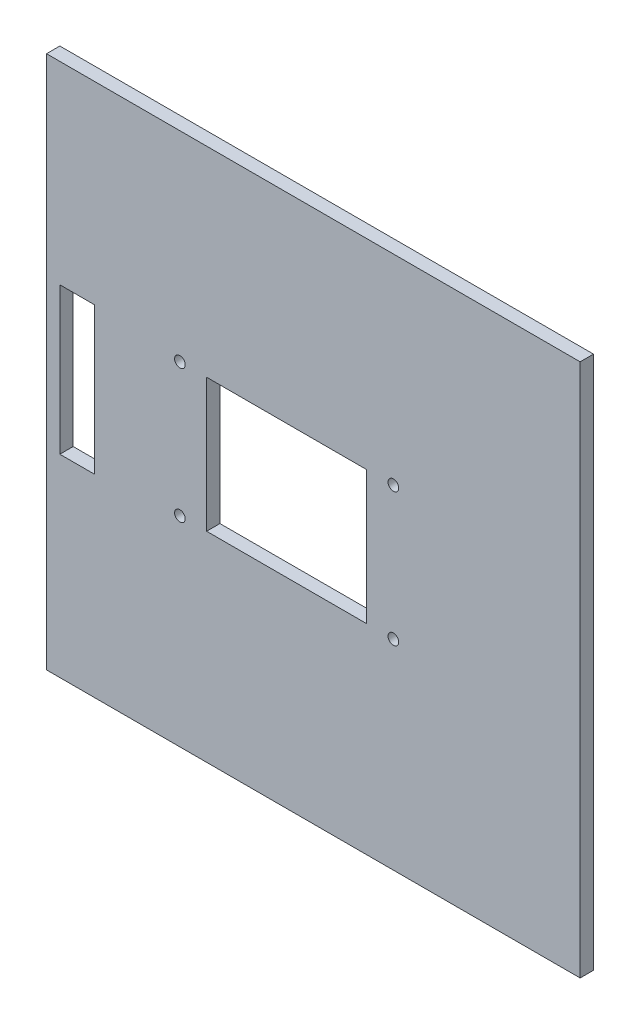
from build123d import *

# Parameters (mm, degrees)
ESQUISSE1_W             = 200
ESQUISSE1_H             = 200
BOSS_EXTRU_1_DEPTH      = 5
ESQUISSE2_R             = 2
ENL_V_MAT_EXTRU_1_DEPTH = 10
ESQUISSE3_W             = 13
ESQUISSE3_H             = 55
ENL_V_MAT_EXTRU_2_DEPTH = 10
ESQUISSE4_W             = 60
ESQUISSE4_H             = 50
ENL_V_MAT_EXTRU_3_DEPTH = 12


with BuildPart() as part:
    # Esquisse1 → Boss.-Extru.1 (new body)
    with BuildSketch(Plane.XY):
        with Locations((100, 100)):
            Rectangle(ESQUISSE1_W, ESQUISSE1_H)
    extrude(amount=BOSS_EXTRU_1_DEPTH)

    # Esquisse2 → Enlèv. mat.-Extru.1 (cut)
    with BuildSketch(Plane.XY.offset(5)):
        with Locations((50, 125)):
            Circle(ESQUISSE2_R)
        with Locations((50, 75)):
            Circle(ESQUISSE2_R)
        with Locations((130, 125)):
            Circle(ESQUISSE2_R)
        with Locations((130, 75)):
            Circle(ESQUISSE2_R)
    extrude(amount=-ENL_V_MAT_EXTRU_1_DEPTH, mode=Mode.SUBTRACT)

    # Esquisse3 → Enlèv. mat.-Extru.2 (cut)
    with BuildSketch(Plane.XY.offset(5)):
        with Locations((11.5, 100)):
            Rectangle(ESQUISSE3_W, ESQUISSE3_H)
    extrude(amount=-ENL_V_MAT_EXTRU_2_DEPTH, mode=Mode.SUBTRACT)

    # Esquisse4 → Enlèv. mat.-Extru.3 (cut)
    with BuildSketch(Plane.XY.offset(5)):
        with Locations((90, 100)):
            Rectangle(ESQUISSE4_W, ESQUISSE4_H)
    extrude(amount=-ENL_V_MAT_EXTRU_3_DEPTH, mode=Mode.SUBTRACT)


solid = part.part
